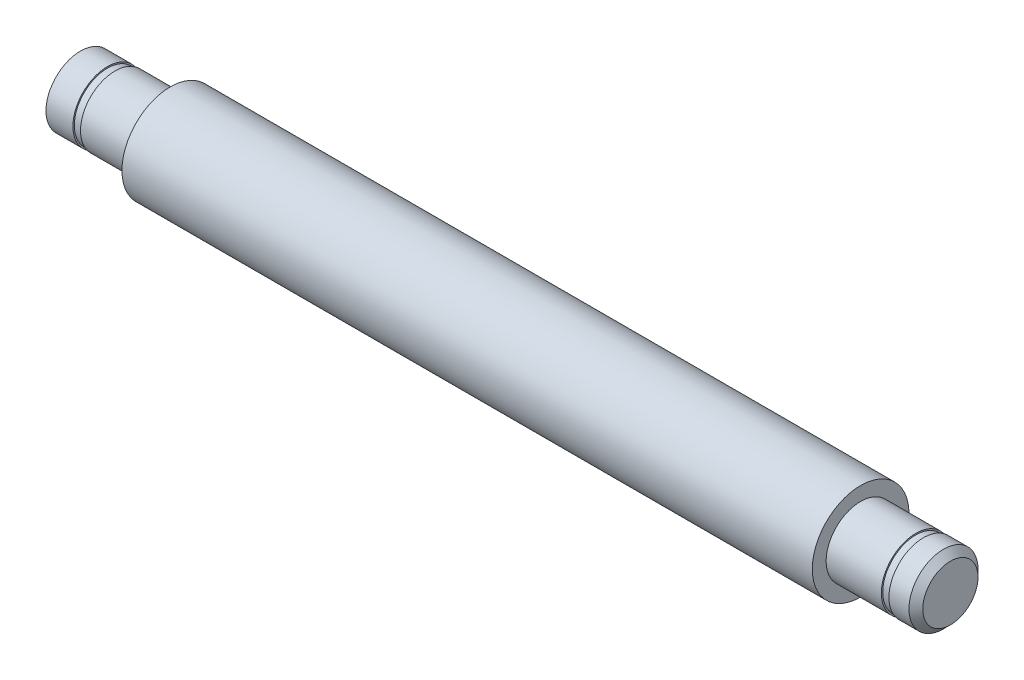
from build123d import *

# Parameters (mm, degrees)
SKIZZE2_W  = 1.1
SKIZZE2_H  = 0.2
FASE1_SIZE = 1


with BuildPart() as part:
    # Skizze1 → Rotation1 (revolve)
    with BuildSketch(Plane(origin=(0, 0, 0), x_dir=(1, 0, 0), z_dir=(0, 1, 0))):
        Polygon((-63, -5), (-50, -5), (-50, -7), (50, -7), (50, -5), (63, -5), (63, 0), (-63, 0), align=None)
    revolve(axis=Axis((-125.234019669, 0, 0), (1, 0, 0)))

    # Skizze2 → Schnitt-Rotation1 (revolve, cut)
    with BuildSketch(Plane(origin=(0, 0, 0), x_dir=(1, 0, 0), z_dir=(0, 1, 0))):
        with Locations((58.55, -4.9)):
            Rectangle(SKIZZE2_W, SKIZZE2_H)
        with Locations((-58.55, -4.9)):
            Rectangle(SKIZZE2_W, SKIZZE2_H)
    revolve(axis=Axis((0, 0, 0), (1, 0, 0)), mode=Mode.SUBTRACT)

    # Fase1
    fase1_edges = [part.edges().sort_by_distance(p)[0] for p in [
        (63, 0, -5),
    ]]
    chamfer(fase1_edges, length=FASE1_SIZE)


solid = part.part
